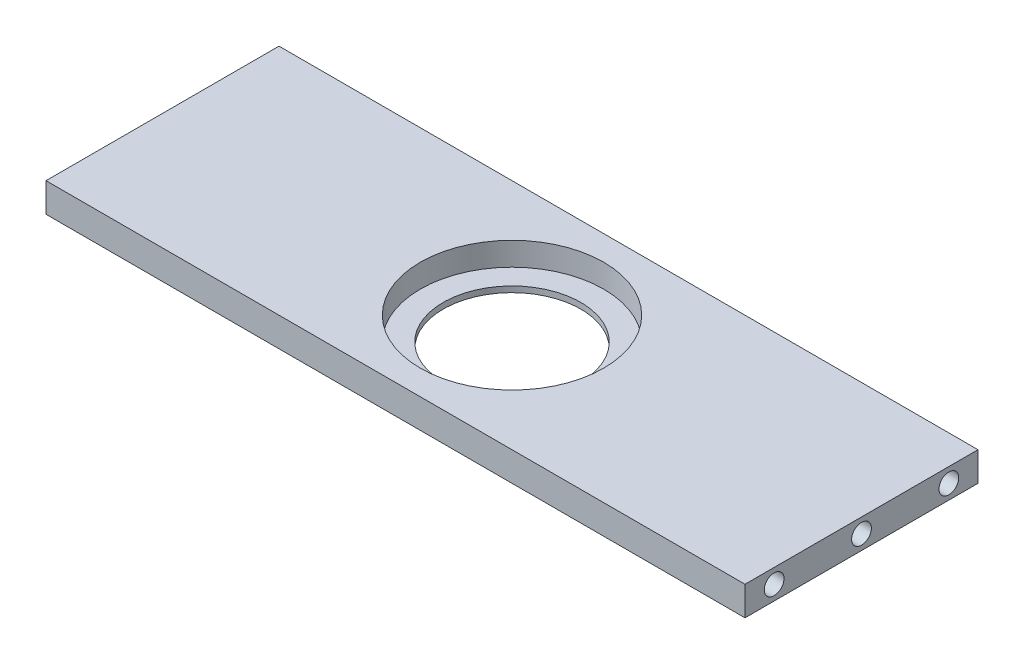
from build123d import *

# Parameters (mm, degrees)
SKETCH1_W           = 152.4
SKETCH1_H           = 50.8
BOSS_EXTRUDE1_DEPTH = 6.35
SKETCH2_R           = 20
CUT_EXTRUDE1_DEPTH  = 5.08
SKETCH3_R           = 15
CUT_EXTRUDE2_DEPTH  = 81.48233595
SKETCH5_R           = 2.15265
CUT_EXTRUDE4_DEPTH  = 25.4


with BuildPart() as part:
    # Sketch1 → Boss-Extrude1 (new body)
    with BuildSketch(Plane(origin=(0, 0, 0), x_dir=(1, 0, 0), z_dir=(0, 1, 0))):
        Rectangle(SKETCH1_W, SKETCH1_H)
    extrude(amount=-BOSS_EXTRUDE1_DEPTH)

    # Sketch2 → Cut-Extrude1 (cut)
    with BuildSketch(Plane(origin=(0, 0, 0), x_dir=(1, 0, 0), z_dir=(0, 1, 0))):
        with Locations(Location((0, 0, 0), (0, 0, 270))):
            Circle(SKETCH2_R)
    extrude(amount=-CUT_EXTRUDE1_DEPTH, mode=Mode.SUBTRACT)

    # Sketch3 → Cut-Extrude2 (cut, through all)
    with BuildSketch(Plane(origin=(0, -5.08, 0), x_dir=(1, 0, 0), z_dir=(0, 1, 0))):
        with Locations(Location((0, 0, 0), (0, 0, 270))):
            Circle(SKETCH3_R)
    extrude(amount=-CUT_EXTRUDE2_DEPTH, mode=Mode.SUBTRACT)

    # Sketch5 → Cut-Extrude4 (cut)
    with BuildSketch(Plane.ZY.offset(76.2)):
        with Locations((0, -3.175)):
            Circle(SKETCH5_R)
        with Locations((19.05, -3.175)):
            Circle(SKETCH5_R)
        with Locations(Location((-19.05, -3.175, 0), (0, 0, 180))):
            Circle(SKETCH5_R)
    cut_extrude4 = extrude(amount=-CUT_EXTRUDE4_DEPTH, mode=Mode.SUBTRACT)

    # Mirror1: Cut-Extrude4 across plane
    add(cut_extrude4.mirror(Plane(origin=(0, 0, 0), x_dir=(0, 0, 1), z_dir=(1, 0, 0))), mode=Mode.SUBTRACT)


solid = part.part
